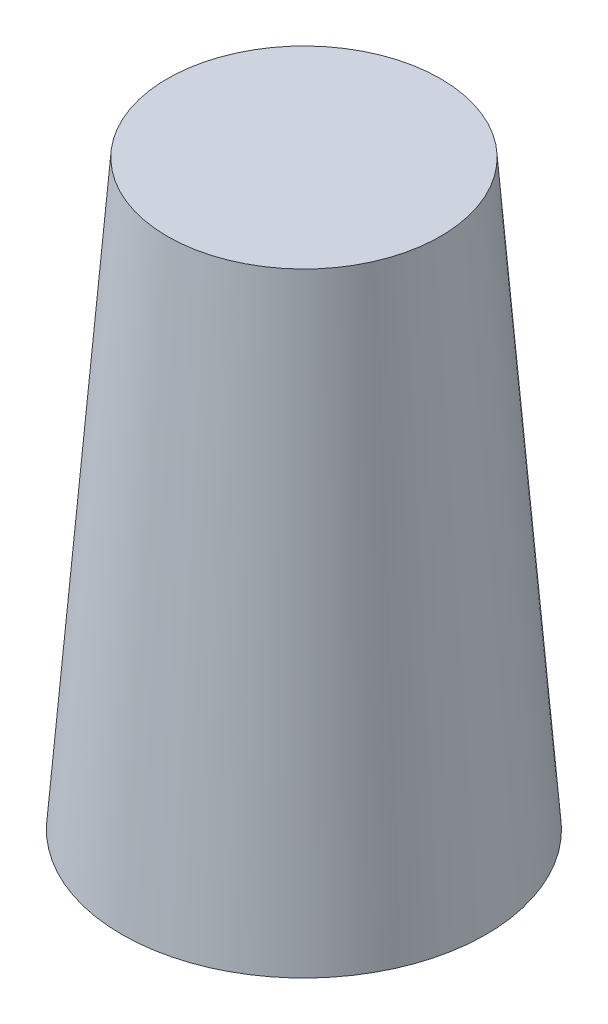
from build123d import *


with BuildPart() as part:
    # Esquisse1 → Révolution1 (revolve)
    with BuildSketch(Plane.XY, mode=Mode.PRIVATE) as r_volution1_sk:
        Polygon((0, 115), (27, 115), (36, 0), (34.495413439, 0), (25.612804744, 113.5), (0, 113.5), align=None)
    revolve(r_volution1_sk.sketch.rotate(Axis((0, 115, 0), (0, -1, 0)), 90), axis=Axis((0, 115, 0), (0, -1, 0)))


solid = part.part
